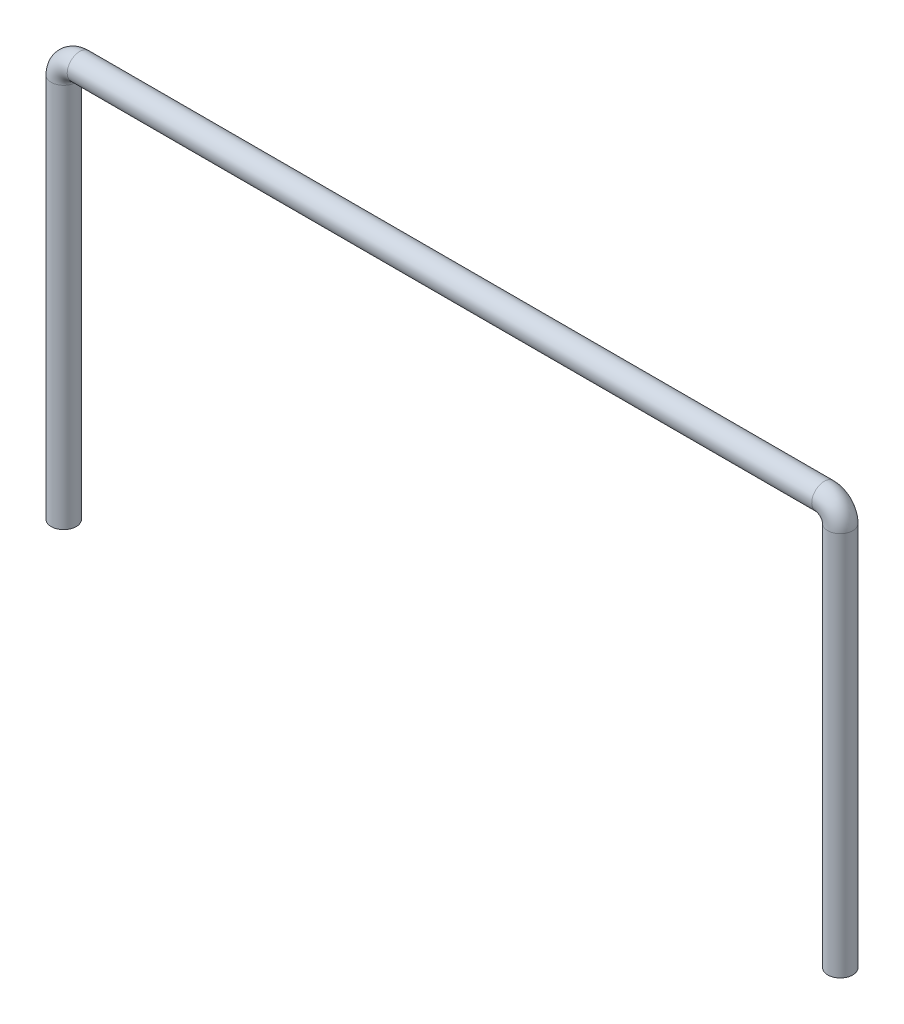
from build123d import *

# Parameters (mm, degrees)
SKETCH2_R = 0.1984375


with BuildPart() as part:
    # Sweep3: sweep along a path in Sketch1
    with BuildLine(Plane.XY) as sweep3_path:
        Line((-6.1515625, -6.35), (-6.1515625, -0.254))
        ThreePointArc((-6.1515625, -0.254), (-6.077167622, -0.074394878), (-5.8975625, 0))
        Line((-5.8975625, 0), (5.8975625, 0))
        ThreePointArc((5.8975625, 0), (6.077167622, -0.074394878), (6.1515625, -0.254))
        Line((6.1515625, -0.254), (6.1515625, -6.35))
    # Sketch2 → Sweep3 (sweep)
    with BuildSketch(Plane(origin=(0, -6.35, 0), x_dir=(1, 0, 0), z_dir=(0, 1, 0))):
        with Locations((-6.1515625, 0)):
            Circle(SKETCH2_R)
    sweep(path=sweep3_path.line)


solid = part.part
